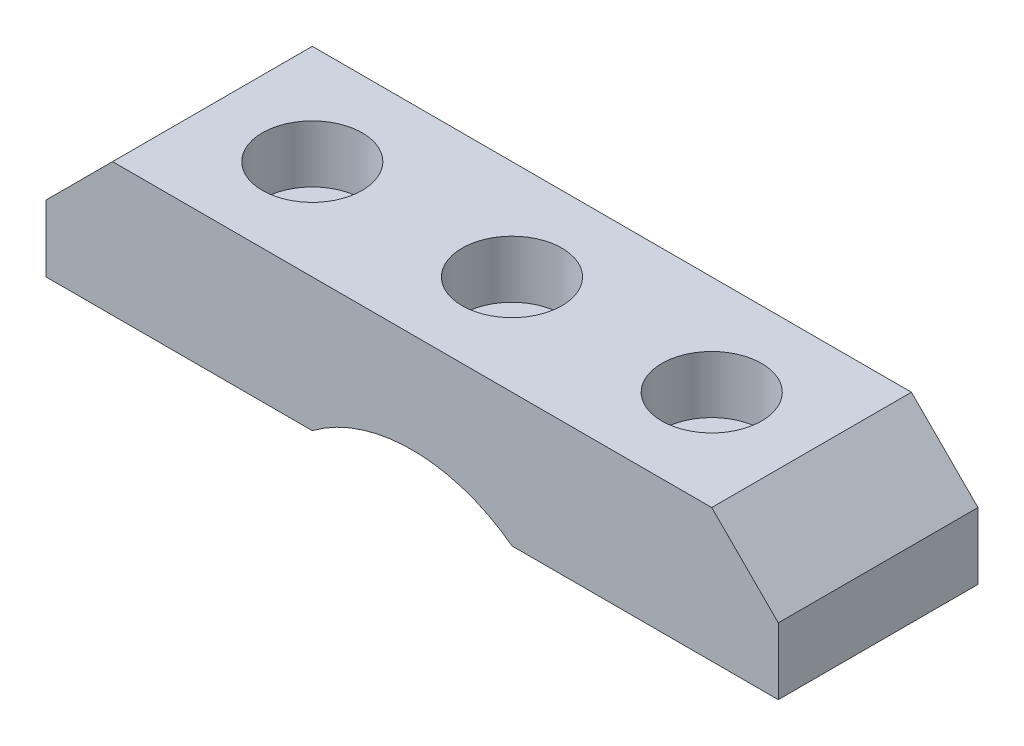
from build123d import *

# Parameters (mm, degrees)
EXTRUDE_1_DEPTH             = 15
HOLE_WIZARD_M81_D           = 9
HOLE_WIZARD_M81_CBORE_D     = 15
HOLE_WIZARD_M81_CBORE_DEPTH = 8.6
CHAMFER_1_SIZE              = 10


with BuildPart() as part:
    # Эскиз1 → Бобышка-Вытянуть1 (new, symmetric)
    with BuildSketch(Plane.XY):
        with BuildLine():
            Line((-15, 20), (-55, 20))
            Line((-55, 20), (-55, 40))
            Line((-55, 40), (55, 40))
            Line((55, 40), (55, 20))
            Line((55, 20), (15, 20))
            ThreePointArc((15, 20), (0, 25), (-15, 20))
        make_face()
    extrude(amount=EXTRUDE_1_DEPTH, both=True)

    # Цековка для винта с внутренним шестигранником M81 (through all)
    with Locations(Plane(origin=(0, 40, 0), x_dir=(1, 0, 0), z_dir=(0, 1, 0))):
        with Locations((0, 0), (-30, 0), (30, 0)):
            CounterBoreHole(HOLE_WIZARD_M81_D / 2, HOLE_WIZARD_M81_CBORE_D / 2, HOLE_WIZARD_M81_CBORE_DEPTH)

    # Фаска1
    chamfer_1_edges = [part.edges().sort_by_distance(p)[0] for p in [
        (-55, 40, 0),
        (55, 40, 0),
    ]]
    chamfer(chamfer_1_edges, length=CHAMFER_1_SIZE)


solid = part.part
